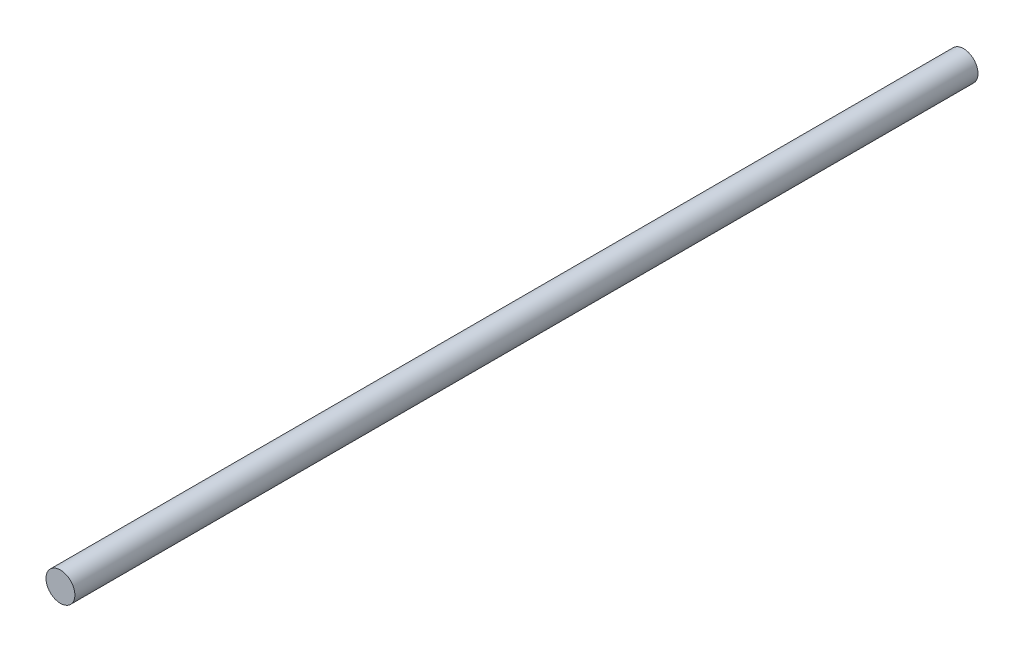
from build123d import *

# Parameters (mm, degrees)
SKETCH1_R           = 8
BOSS_EXTRUDE1_DEPTH = 500


with BuildPart() as part:
    # Sketch1 → Boss-Extrude1 (new body)
    with BuildSketch(Plane.XY):
        Circle(SKETCH1_R)
    extrude(amount=BOSS_EXTRUDE1_DEPTH)


solid = part.part
